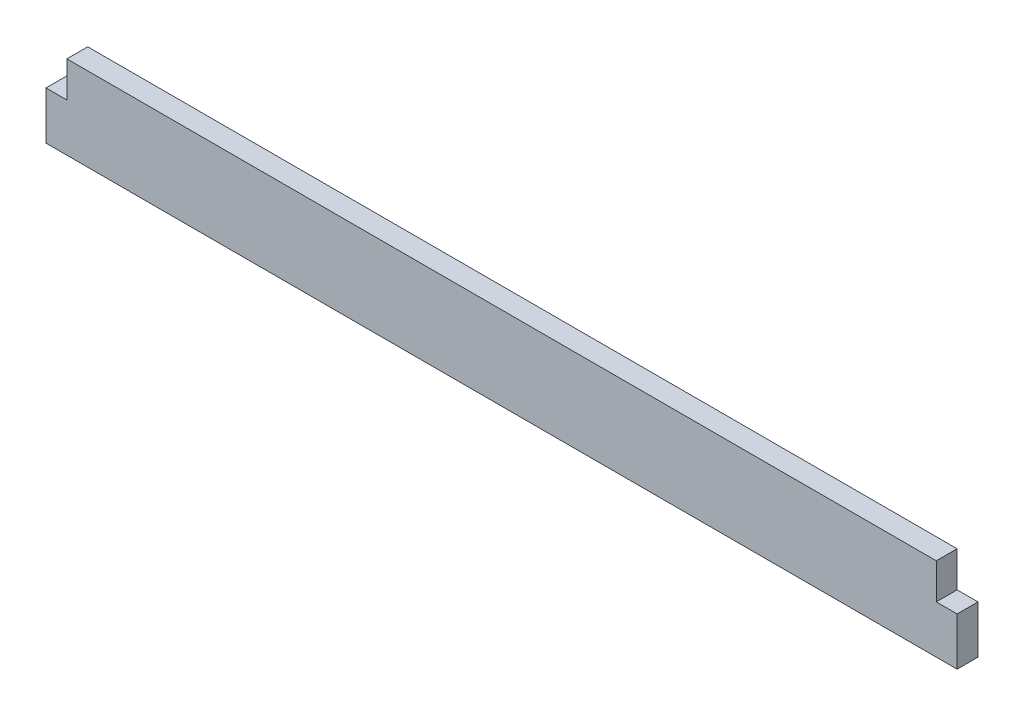
from build123d import *

# Parameters (mm, degrees)
BOSS_EXTRUDE1_DEPTH = 3


with BuildPart() as part:
    # Sketch1 → Boss-Extrude1 (new body)
    with BuildSketch(Plane.XY):
        Polygon((12, 12), (0, 12), (0, 6.882729847), (-3, 6.882729847), (-3, 0), (128, 0), (128, 6.882729847), (125, 6.882729847), (125, 12), (113, 12), align=None)
    extrude(amount=BOSS_EXTRUDE1_DEPTH)


solid = part.part
